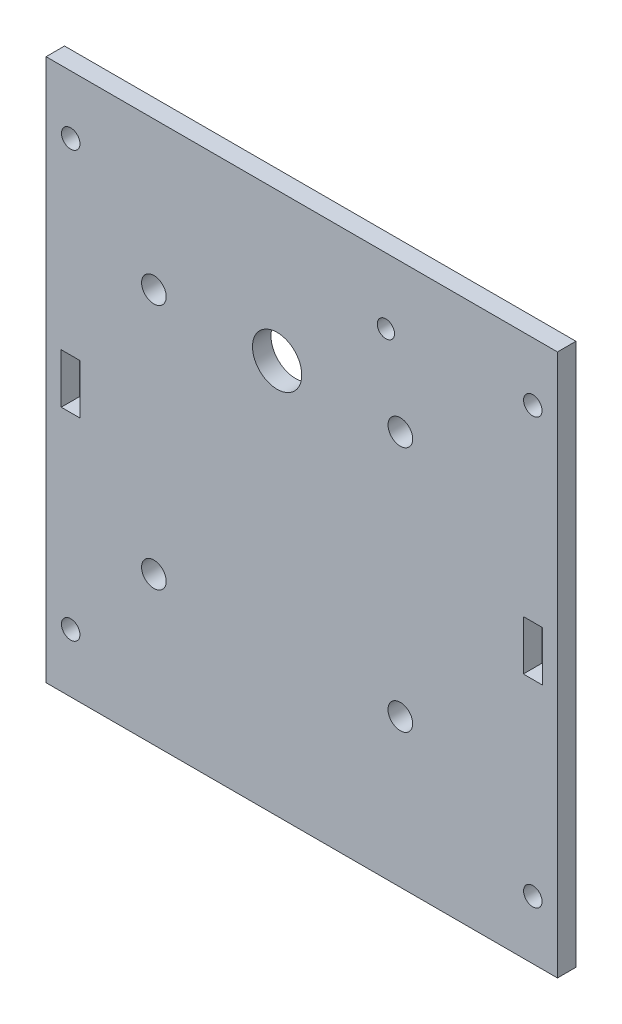
from build123d import *

# Parameters (mm, degrees)
SKETCH_1_W      = 83
SKETCH_1_H      = 88
SKETCH_1_R      = 1.5
SKETCH_1_R_2    = 2
SKETCH_1_R_3    = 4
SKETCH_1_R_4    = 1.400374755
SKETCH_1_W_2    = 3.08
SKETCH_1_H_2    = 8.08
EXTRUDE_1_DEPTH = 3


with BuildPart() as part:
    # 草图1 → 凸台-拉伸1 (new body)
    with BuildSketch(Plane.XY):
        with Locations((-21.653153153, -12.882882883)):
            Rectangle(SKETCH_1_W, SKETCH_1_H)
        with Locations((-59.153153153, 21.617117117)):
            Circle(SKETCH_1_R, mode=Mode.SUBTRACT)
        with Locations((15.846846847, 21.617117117)):
            Circle(SKETCH_1_R, mode=Mode.SUBTRACT)
        with Locations((-59.153153153, -47.382882883)):
            Circle(SKETCH_1_R, mode=Mode.SUBTRACT)
        with Locations((15.846846847, -47.382882883)):
            Circle(SKETCH_1_R, mode=Mode.SUBTRACT)
        with Locations((-5.653153153, -32.882882883)):
            Circle(SKETCH_1_R_2, mode=Mode.SUBTRACT)
        with Locations((-45.653153153, -32.882882883)):
            Circle(SKETCH_1_R_2, mode=Mode.SUBTRACT)
        with Locations((-45.653153153, 7.117117117)):
            Circle(SKETCH_1_R_2, mode=Mode.SUBTRACT)
        with Locations((-5.653153153, 7.117117117)):
            Circle(SKETCH_1_R_2, mode=Mode.SUBTRACT)
        with Locations((-25.653153153, 7.117117117)):
            Circle(SKETCH_1_R_3, mode=Mode.SUBTRACT)
        with Locations((-7.998369036, 20.441702668)):
            Circle(SKETCH_1_R_4, mode=Mode.SUBTRACT)
        with Locations((-59.153153153, -12.882882883)):
            Rectangle(SKETCH_1_W_2, SKETCH_1_H_2, mode=Mode.SUBTRACT)
        with Locations((15.846846847, -12.882882883)):
            Rectangle(SKETCH_1_W_2, SKETCH_1_H_2, mode=Mode.SUBTRACT)
    extrude(amount=EXTRUDE_1_DEPTH)


solid = part.part
